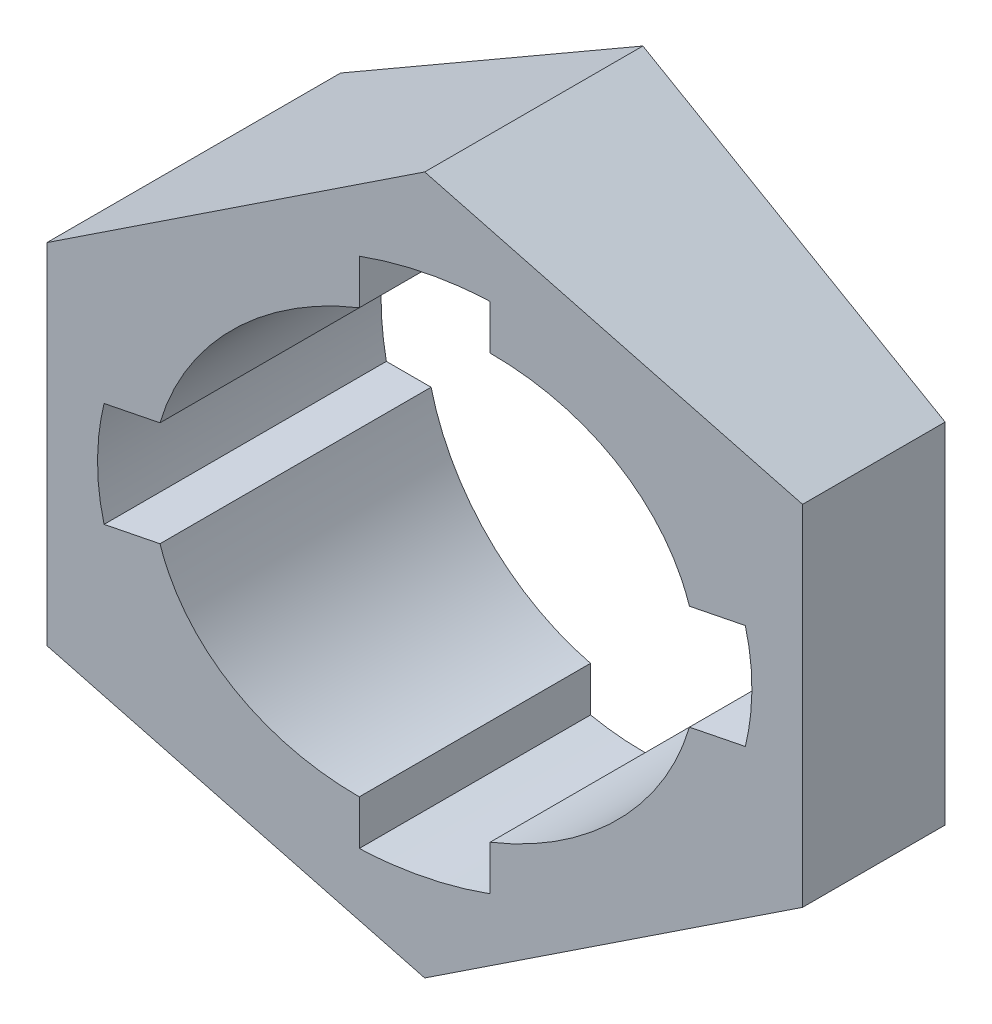
from build123d import *

# Parameters (mm, degrees)
SKETCH1_W           = 80
SKETCH1_H           = 80
BOSS_EXTRUDE1_DEPTH = 35
CUT_EXTRUDE1_REACH  = 120.427
CUT_EXTRUDE2_DEPTH  = 35


with BuildPart() as part:
    # Sketch1 → Boss-Extrude1 (new body)
    with BuildSketch(Plane.XY):
        with Locations((-40, 40)):
            Rectangle(SKETCH1_W, SKETCH1_H)
    extrude(amount=BOSS_EXTRUDE1_DEPTH)

    # Sketch4 → Cut-Extrude1 (cut, up to next)
    with BuildSketch(Plane.XZ, mode=Mode.PRIVATE) as cut_extrude1_sk1:
        Polygon((-80, 35), (0, 15), (0, 35), align=None)
    cut_extrude1_tool1 = extrude(cut_extrude1_sk1.sketch, amount=-CUT_EXTRUDE1_REACH, mode=Mode.PRIVATE) & part.part
    add(cut_extrude1_tool1.solids().sort_by_distance((-26.666667, 0, 28.333333))[0], mode=Mode.SUBTRACT)

    # Sketch5 → Cut-Extrude2 (cut)
    with BuildSketch(Plane(origin=(0, 0, 0), x_dir=(-1, 0, 0), z_dir=(0, 0, -1))):
        with BuildLine():
            Line((34, 69.393876913), (34, 64.269322199))
            ThreePointArc((34, 64.269322199), (22.32233047, 57.67766953), (15.730677801, 46))
            Line((15.730677801, 46), (10.606123087, 46))
            ThreePointArc((10.606123087, 46), (10, 40), (10.606123087, 34))
            Line((10.606123087, 34), (15.730677801, 34))
            ThreePointArc((15.730677801, 34), (22.32233047, 22.32233047), (34, 15.730677801))
            Line((34, 15.730677801), (34, 10.606123087))
            ThreePointArc((34, 10.606123087), (40, 10), (46, 10.606123087))
            Line((46, 10.606123087), (46, 15.730677801))
            ThreePointArc((46, 15.730677801), (57.67766953, 22.32233047), (64.269322199, 34))
            Line((64.269322199, 34), (69.393876913, 34))
            ThreePointArc((69.393876913, 34), (70, 40), (69.393876913, 46))
            Line((69.393876913, 46), (64.269322199, 46))
            ThreePointArc((64.269322199, 46), (57.67766953, 57.67766953), (46, 64.269322199))
            Line((46, 64.269322199), (46, 69.393876913))
            ThreePointArc((46, 69.393876913), (40, 70), (34, 69.393876913))
        make_face()
        Polygon((5.358983849, 60), (40, 80), (0, 80), (0, 0), (40, 0), (5.358983849, 20), align=None)
        Polygon((80, 80), (40, 80), (74.641016151, 60), (74.641016151, 20), (40, 0), (80, 0), align=None)
    extrude(amount=-CUT_EXTRUDE2_DEPTH, mode=Mode.SUBTRACT)


solid = part.part
